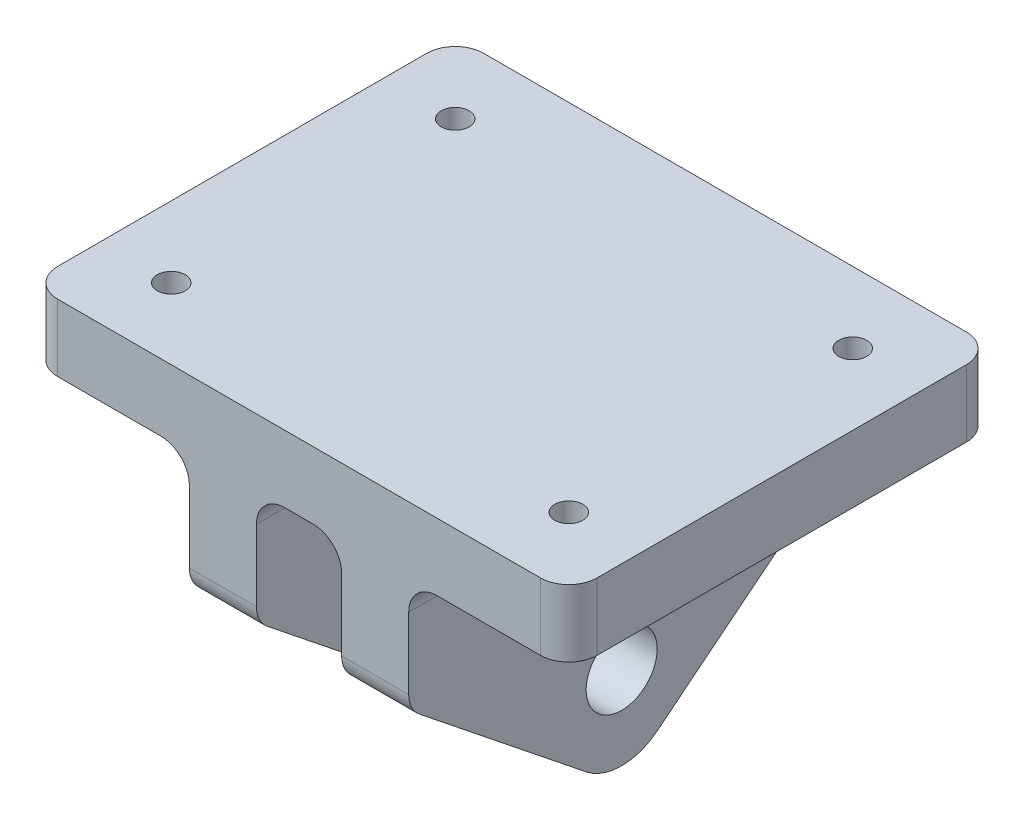
from build123d import *
from OCP.BRepFilletAPI import BRepFilletAPI_MakeFillet

# Parameters (mm, degrees)
SKETCH1_R           = 3.175
BOSS_EXTRUDE1_DEPTH = 6
BOSS_EXTRUDE2_START = -3.81
SKETCH1_3_W         = 38.1
SKETCH1_3_H         = 5.999999938
BOSS_EXTRUDE2_DEPTH = 24.13
SKETCH3_R           = 1.25
CUT_EXTRUDE1_DEPTH  = 44.944503594
FILLET1_R1          = 2.54
FILLET1_R2          = 5.08


with BuildPart() as part:
    # Sketch1 → Boss-Extrude1 (new body)
    with BuildSketch(Plane(origin=(3.81, 0, 0), x_dir=(0, 0, -1), z_dir=(1, 0, 0))):
        Polygon((-19.05, 0), (-19.05, -10.16), (0, -25.4), (19.05, -10.16), (19.05, 0), align=None)
        with Locations((0, -16.51)):
            Circle(SKETCH1_R, mode=Mode.SUBTRACT)
    boss_extrude1 = extrude(amount=BOSS_EXTRUDE1_DEPTH)

    # Sketch1<3> → Boss-Extrude2 (add)
    with BuildSketch(Plane(origin=(3.81, 0, 0), x_dir=(0, 0, -1), z_dir=(1, 0, 0)).offset(BOSS_EXTRUDE2_START)):
        with Locations((0, 2.999999969)):
            Rectangle(SKETCH1_3_W, SKETCH1_3_H)
    boss_extrude2 = extrude(amount=BOSS_EXTRUDE2_DEPTH)

    # Sketch3 → Cut-Extrude1 (cut, through all)
    with BuildSketch(Plane(origin=(0, 5.999999938, 0), x_dir=(1, 0, 0), z_dir=(0, 1, 0))):
        with Locations(Location((17.78, 12.7, 0), (0, 0, 270))):
            Circle(SKETCH3_R)
        with Locations(Location((17.78, -12.7, 0), (0, 0, 90))):
            Circle(SKETCH3_R)
    cut_extrude1 = extrude(amount=-CUT_EXTRUDE1_DEPTH, mode=Mode.SUBTRACT)

    # Mirror2: Boss-Extrude2, Cut-Extrude1 across plane
    add(boss_extrude2.mirror(Plane(origin=(0, 0, 0), x_dir=(0, 0, 1), z_dir=(1, 0, 0))))
    add(cut_extrude1.mirror(Plane(origin=(0, 0, 0), x_dir=(0, 0, 1), z_dir=(1, 0, 0))), mode=Mode.SUBTRACT)

    # Mirror3: Boss-Extrude1 across plane
    add(boss_extrude1.mirror(Plane(origin=(0, 0, 0), x_dir=(0, 0, 1), z_dir=(1, 0, 0))))

    # Fillet1: one fillet with a radius per group of edges: ONE call of the kernel's fillet builder (fillet() takes one radius for all edges)
    fillet1_edges_1 = [part.edges().sort_by_distance(p)[0] for p in [
        (6.81, -10.16, 19.05),
        (6.81, -10.16, -19.05),
        (9.81, 0, 0),
        (24.13, 2.999999969, 19.05),
        (24.13, 2.999999969, -19.05),
        (-24.13, 2.999999969, -19.05),
        (-24.13, 2.999999969, 19.05),
        (-6.81, -10.16, -19.05),
        (-6.81, -10.16, 19.05),
        (-3.81, 0, 0),
        (-9.81, 0, 0),
        (3.81, 0, 0),
    ]]
    fillet1_edges_2 = [part.edges().sort_by_distance(p)[0] for p in [
        (6.81, -25.4, 0),
        (-6.81, -25.4, 0),
    ]]
    fillet1 = BRepFilletAPI_MakeFillet(part.part.solid().wrapped)
    for e in fillet1_edges_1:
        fillet1.Add(FILLET1_R1, e.wrapped)
    for e in fillet1_edges_2:
        fillet1.Add(FILLET1_R2, e.wrapped)
    add(Compound.cast(fillet1.Shape()), mode=Mode.REPLACE)


solid = part.part
